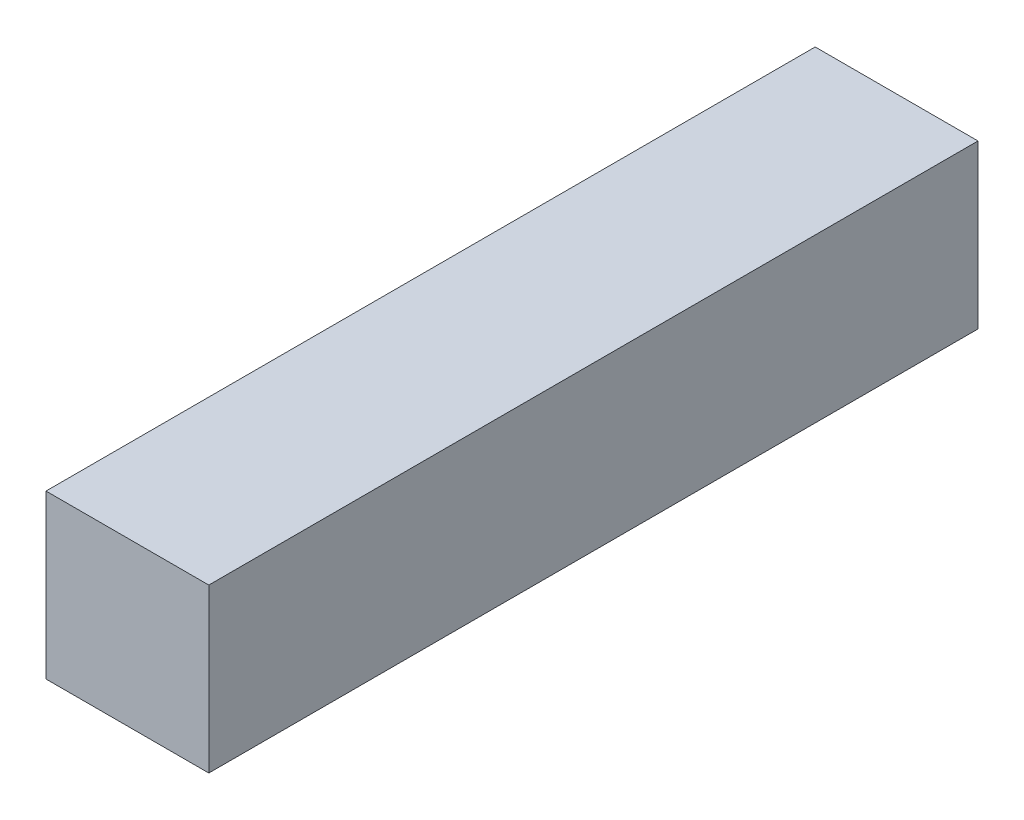
from build123d import *

# Parameters (mm, degrees)
CROQUIS1_W              = 6.35
CROQUIS1_H              = 6.35
SALIENTE_EXTRUIR1_DEPTH = 30


with BuildPart() as part:
    # Croquis1 → Saliente-Extruir1 (new body)
    with BuildSketch(Plane.XY):
        Rectangle(CROQUIS1_W, CROQUIS1_H)
    extrude(amount=SALIENTE_EXTRUIR1_DEPTH)


solid = part.part
